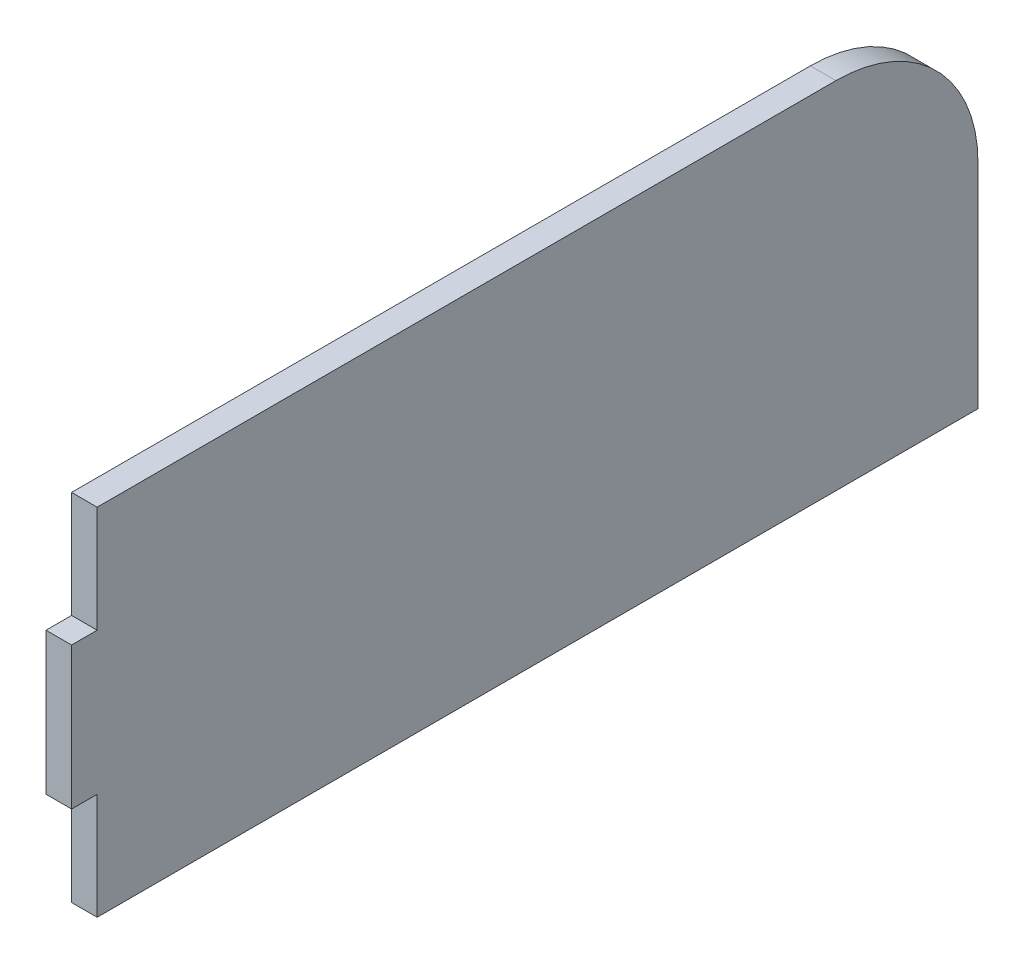
from build123d import *

# Parameters (mm, degrees)
BOSS_EXTRUDE1_DEPTH = 18


with BuildPart() as part:
    # Sketch1 → Boss-Extrude1 (new body)
    with BuildSketch(Plane(origin=(0, 0, 0), x_dir=(0, 0, -1), z_dir=(1, 0, 0))):
        with BuildLine():
            Line((0, -175), (0, -250))
            Line((0, -250), (620, -250))
            Line((620, -250), (620, -100))
            ThreePointArc((620, -100), (590.710678119, -29.289321881), (520, 0))
            Line((520, 0), (0, 0))
            Line((0, 0), (0, -75))
            Line((0, -75), (-18, -75))
            Line((-18, -75), (-18, -175))
            Line((-18, -175), (0, -175))
        make_face()
    extrude(amount=BOSS_EXTRUDE1_DEPTH)


solid = part.part
